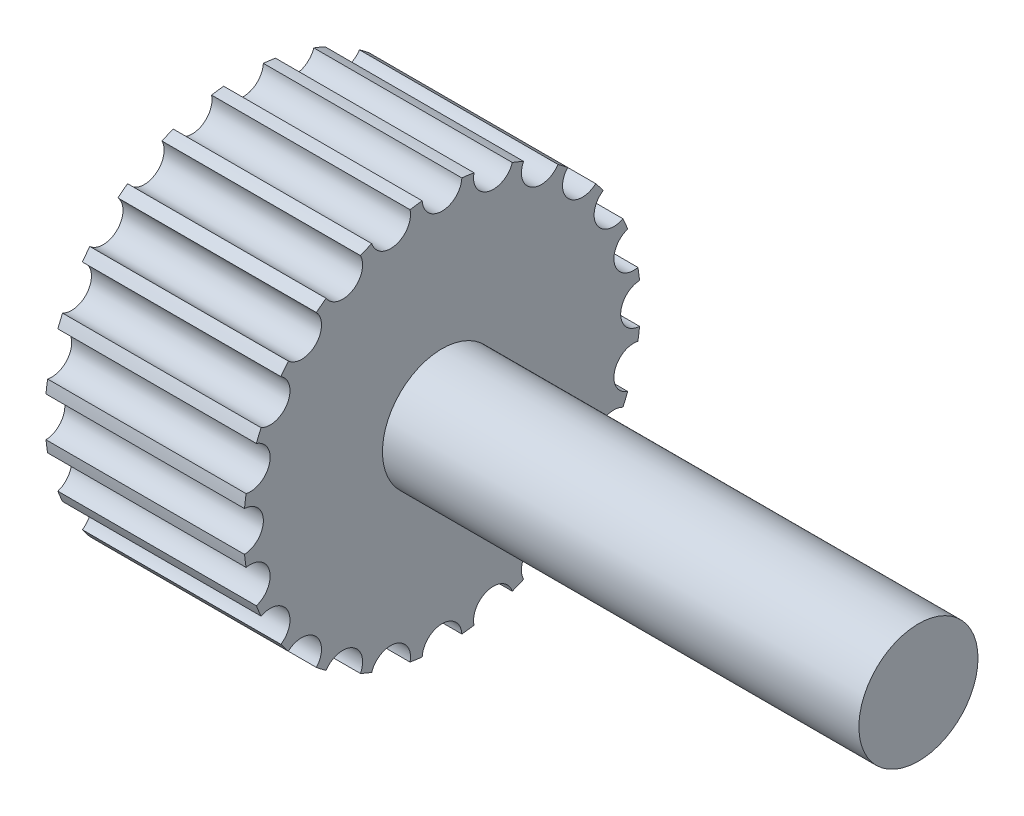
from build123d import *

# Parameters (mm, degrees)
SKETCH1_R           = 5
BOSS_EXTRUDE1_DEPTH = 5
SKETCH2_R           = 1.5
BOSS_EXTRUDE2_DEPTH = 17
SKETCH3_R           = 0.5
CUT_EXTRUDE2_DEPTH  = 5
CIRPATTERN1_COUNT   = 24


with BuildPart() as part:
    # Sketch1 → Boss-Extrude1 (new body)
    with BuildSketch(Plane(origin=(0, 0, 0), x_dir=(0, 0, -1), z_dir=(1, 0, 0))):
        Circle(SKETCH1_R)
    extrude(amount=BOSS_EXTRUDE1_DEPTH)

    # Sketch2 → Boss-Extrude2 (add)
    with BuildSketch(Plane(origin=(0, 0, 0), x_dir=(0, 0, -1), z_dir=(1, 0, 0))):
        Circle(SKETCH2_R)
    extrude(amount=BOSS_EXTRUDE2_DEPTH)

    # Sketch3 → Cut-Extrude2 (cut, symmetric)
    with BuildSketch(Plane(origin=(0, 0, 0), x_dir=(0, 0, -1), z_dir=(1, 0, 0))):
        with Locations((5, 0)):
            Circle(SKETCH3_R)
    cut_extrude2 = extrude(amount=CUT_EXTRUDE2_DEPTH, both=True, mode=Mode.SUBTRACT)

    # CirPattern1: Cut-Extrude2 ×24 about axis
    cirpattern1_axis = Axis((-0.85, 0, 0), (1, 0, 0))
    for i in range(1, CIRPATTERN1_COUNT):
        add(cut_extrude2.rotate(cirpattern1_axis, i * 360 / CIRPATTERN1_COUNT), mode=Mode.SUBTRACT)


solid = part.part
